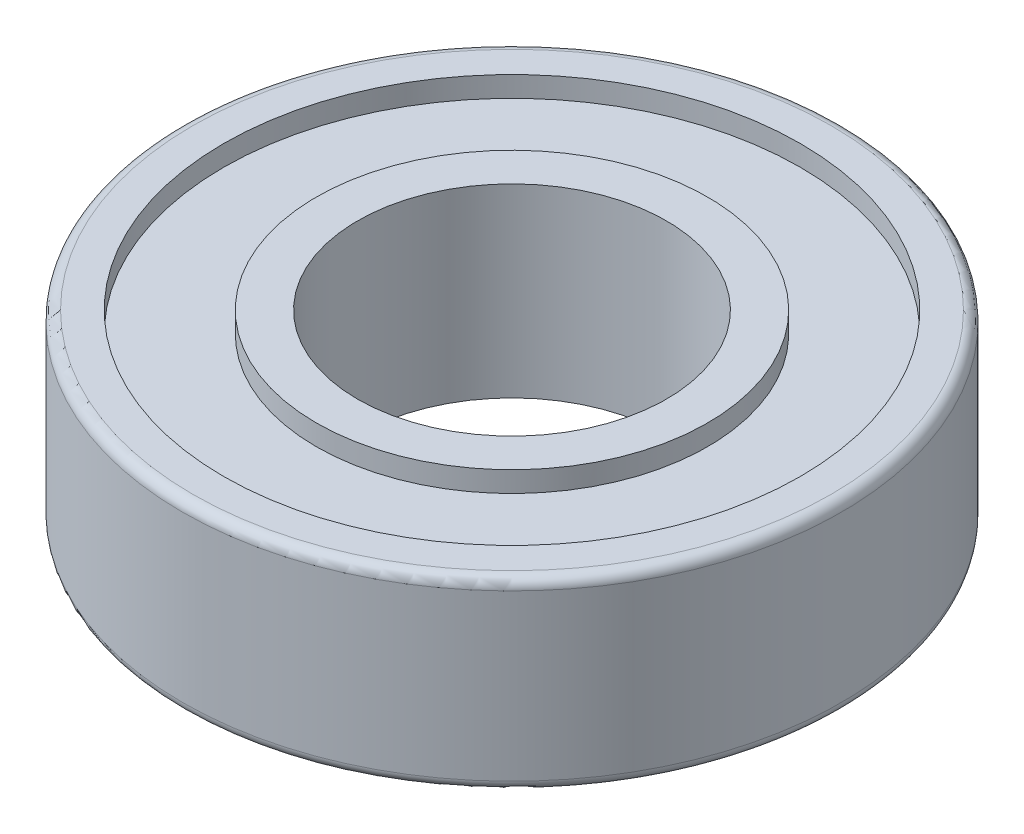
from build123d import *

# Parameters (mm, degrees)
DISQUE_INT_RIEUR_W              = 2
DISQUE_INT_RIEUR_H              = 9
DISQUE_EXT_RIEUR_W              = 2
DISQUE_EXT_RIEUR_H              = 9
DISQUE_INTERM_DIAIRE_W          = 4.5
DISQUE_INTERM_DIAIRE_H          = 7
CONG_1_DISQUE_EXT_RIEUR_0_5MM_R = 0.5


with BuildPart() as part:
    # Disque_Intérieur → Révolution1_Disque_Intérieur (revolve)
    with BuildSketch(Plane.XY, mode=Mode.PRIVATE) as r_volution1_disque_int_rieur_sk:
        with Locations((8.5, 0)):
            Rectangle(DISQUE_INT_RIEUR_W, DISQUE_INT_RIEUR_H)
    revolve(r_volution1_disque_int_rieur_sk.sketch.rotate(Axis((0, 4.95, 0), (0, -1, 0)), 90), axis=Axis((0, 4.95, 0), (0, -1, 0)))



with BuildPart() as body_2:
    # Disque_extérieur → Révolution2_Disque_extérieur (revolve)
    with BuildSketch(Plane.XY, mode=Mode.PRIVATE) as r_volution2_disque_ext_rieur_sk:
        with Locations((15, 0)):
            Rectangle(DISQUE_EXT_RIEUR_W, DISQUE_EXT_RIEUR_H)
    revolve(r_volution2_disque_ext_rieur_sk.sketch.rotate(Axis((0, 4.95, 0), (0, -1, 0)), 90), axis=Axis((0, 4.95, 0), (0, -1, 0)))


with BuildPart() as part_1:
    add(part.part)

    add(body_2.part)  # Révolution3_Disque_Intermédiaire merges body 2
    # Disque_Intermédiaire → Révolution3_Disque_Intermédiaire (revolve)
    with BuildSketch(Plane.XY, mode=Mode.PRIVATE) as r_volution3_disque_interm_diaire_sk:
        with Locations((11.75, 0)):
            Rectangle(DISQUE_INTERM_DIAIRE_W, DISQUE_INTERM_DIAIRE_H)
    revolve(r_volution3_disque_interm_diaire_sk.sketch.rotate(Axis((0, 4.95, 0), (0, -1, 0)), 90), axis=Axis((0, 4.95, 0), (0, -1, 0)))

    # Congé1_Disque_extérieur_0.5mm
    cong_1_disque_ext_rieur_0_5mm_edges = [part_1.edges().sort_by_distance(p)[0] for p in [
        (0, -4.5, -16),
        (0, 4.5, -16),
    ]]
    fillet(cong_1_disque_ext_rieur_0_5mm_edges, radius=CONG_1_DISQUE_EXT_RIEUR_0_5MM_R)


solid = part_1.part
